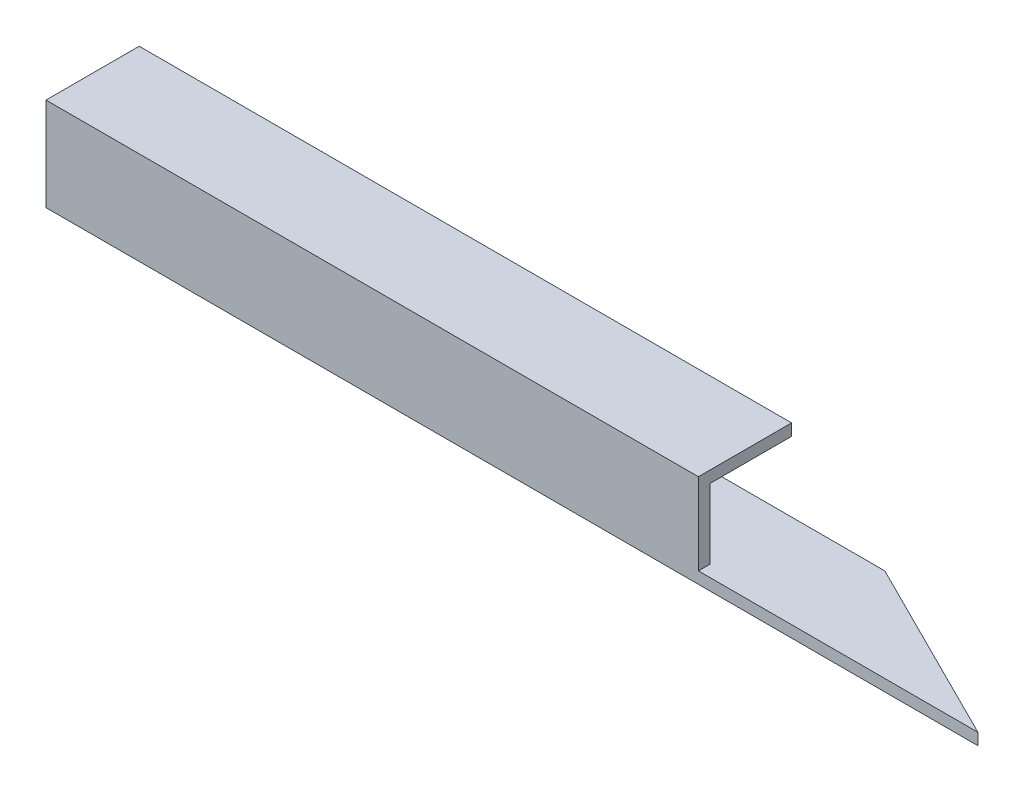
from build123d import *

# Parameters (mm, degrees)
BOSS_EXTRUDE1_DEPTH = 25.4
SKETCH2_W           = 19.05
SKETCH2_H           = 19.05
CUT_EXTRUDE1_DEPTH  = 257.020099216
CUT_EXTRUDE2_DEPTH  = 22.225
SKETCH5_W           = 177.8
SKETCH5_H           = 19.05
CUT_EXTRUDE4_DEPTH  = 22.225


with BuildPart() as part:
    # Sketch1 → Boss-Extrude1 (new body)
    with BuildSketch(Plane(origin=(0, 0, 0), x_dir=(1, 0, 0), z_dir=(0, 1, 0))):
        Polygon((-78.640492639, -19.624759931), (175.359507361, -19.624759931), (124.559507361, 5.775240069), (-78.640492639, 5.775240069), align=None)
    extrude(amount=BOSS_EXTRUDE1_DEPTH)

    # Sketch2 → Cut-Extrude1 (cut, through all)
    with BuildSketch(Plane.ZY.offset(78.640492639)):
        with Locations((6.924759931, 12.7)):
            Rectangle(SKETCH2_W, SKETCH2_H)
    extrude(amount=-CUT_EXTRUDE1_DEPTH, mode=Mode.SUBTRACT)

    # Sketch3 → Cut-Extrude2 (cut)
    with BuildSketch(Plane(origin=(0, 25.4, 0), x_dir=(1, 0, 0), z_dir=(0, 1, 0))):
        Polygon((99.159507361, 5.775240069), (99.159507361, -19.624759931), (175.359507361, -19.624759931), (124.559507361, 5.775240069), align=None)
    extrude(amount=-CUT_EXTRUDE2_DEPTH, mode=Mode.SUBTRACT)

    # Sketch5 → Cut-Extrude4 (cut)
    with BuildSketch(Plane(origin=(0, 0, -5.775240069), x_dir=(-1, 0, 0), z_dir=(0, 0, -1))):
        with Locations((-10.259507361, 12.7)):
            Rectangle(SKETCH5_W, SKETCH5_H)
    extrude(amount=-CUT_EXTRUDE4_DEPTH, mode=Mode.SUBTRACT)


solid = part.part
